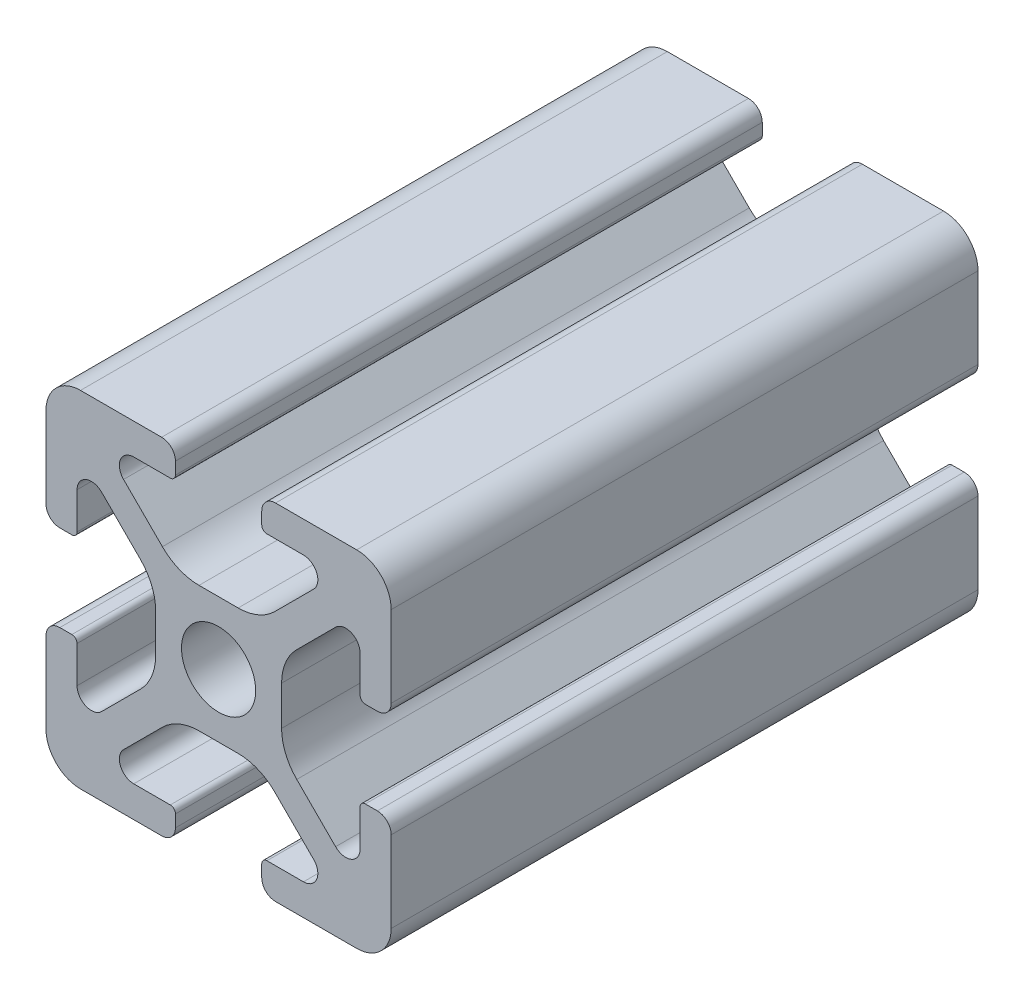
from build123d import *

# Parameters (mm, degrees)
ESQUISSE1_R        = 2.15
BOSS_EXTRU_1_DEPTH = 34


with BuildPart() as part:
    # Esquisse1 → Boss.-Extru.1 (new body)
    with BuildSketch(Plane(origin=(0, 0, 0), x_dir=(-1, 0, 0), z_dir=(0, 0, -1))):
        with BuildLine():
            Line((-12.499999997, 0.800000003), (-12.499999998, 1.500000003))
            ThreePointArc((-12.499999998, 1.500000003), (-12.587867964, 1.712132039), (-12.8, 1.800000005))
            Line((-12.8, 1.800000005), (-14.9175884, 1.800000005))
            ThreePointArc((-14.9175884, 1.800000005), (-15.686636444, 2.31386148), (-15.50619229, 3.2210155))
            Line((-15.50619229, 3.2210155), (-13.25588745, 5.47132034))
            ThreePointArc((-13.25588745, 5.47132034), (-12.282617404, 6.121638593), (-11.134567108, 6.349999996))
            Line((-11.134567108, 6.349999996), (-8.865432907, 6.349999996))
            ThreePointArc((-8.865432907, 6.349999996), (-7.717382611, 6.121638594), (-6.744112567, 5.471320341))
            Line((-6.744112567, 5.471320341), (-4.493807729, 3.221015503))
            ThreePointArc((-4.493807729, 3.221015503), (-4.313363575, 2.313861481), (-5.082411621, 1.800000005))
            Line((-5.082411621, 1.800000005), (-7.20000001, 1.800000005))
            ThreePointArc((-7.20000001, 1.800000005), (-7.412132045, 1.71213204), (-7.50000001, 1.500000005))
            Line((-7.50000001, 1.500000005), (-7.50000001, 0.8))
            ThreePointArc((-7.50000001, 0.8), (-7.265685435, 0.234314575), (-6.70000001, 0))
            Line((-6.70000001, 0), (-2, 0))
            ThreePointArc((-2, 0), (-0.585786438, 0.585786438), (0, 2))
            Line((0, 2), (0, 6.699999998))
            ThreePointArc((0, 6.699999998), (-0.234314576, 7.265685424), (-0.800000003, 7.5))
            Line((-0.800000003, 7.5), (-1.50000001, 7.5))
            ThreePointArc((-1.50000001, 7.5), (-1.712132046, 7.412132033), (-1.800000013, 7.199999997))
            Line((-1.800000013, 7.199999997), (-1.800000013, 5.082411603))
            ThreePointArc((-1.800000013, 5.082411603), (-2.313861487, 4.31336356), (-3.221015507, 4.493807713))
            Line((-3.221015507, 4.493807713), (-5.471320347, 6.744112553))
            ThreePointArc((-5.471320347, 6.744112553), (-6.1216386, 7.717382599), (-6.350000003, 8.865432896))
            Line((-6.350000003, 8.865432896), (-6.350000003, 11.134567102))
            ThreePointArc((-6.350000003, 11.134567102), (-6.121638601, 12.282617397), (-5.471320348, 13.255887442))
            Line((-5.471320348, 13.255887442), (-3.221015512, 15.506192278))
            ThreePointArc((-3.221015512, 15.506192278), (-2.313861489, 15.686636432), (-1.800000013, 14.917588386))
            Line((-1.800000013, 14.917588386), (-1.800000013, 12.799999998))
            ThreePointArc((-1.800000013, 12.799999998), (-1.712132047, 12.587867963), (-1.500000013, 12.499999997))
            Line((-1.500000013, 12.499999997), (-0.8, 12.499999997))
            ThreePointArc((-0.8, 12.499999997), (-0.234314575, 12.734314573), (0, 13.299999998))
            Line((0, 13.299999998), (0, 18))
            ThreePointArc((0, 18), (-0.585786438, 19.414213562), (-2, 20))
            Line((-2, 20), (-6.700000008, 20))
            ThreePointArc((-6.700000008, 20), (-7.265685435, 19.765685424), (-7.50000001, 19.199999998))
            Line((-7.50000001, 19.199999998), (-7.50000001, 18.500000005))
            ThreePointArc((-7.50000001, 18.500000005), (-7.412132044, 18.287867969), (-7.200000008, 18.200000003))
            Line((-7.200000008, 18.200000003), (-5.082411594, 18.200000003))
            ThreePointArc((-5.082411594, 18.200000003), (-4.313363546, 17.686138526), (-4.493807701, 16.778984501))
            Line((-4.493807701, 16.778984501), (-6.744112542, 14.528679659))
            ThreePointArc((-6.744112542, 14.528679659), (-7.717382588, 13.878361406), (-8.865432885, 13.650000003))
            Line((-8.865432885, 13.650000003), (-11.134567112, 13.650000003))
            ThreePointArc((-11.134567112, 13.650000003), (-12.282617407, 13.878361405), (-13.255887452, 14.528679658))
            Line((-13.255887452, 14.528679658), (-15.506192292, 16.778984498))
            ThreePointArc((-15.506192292, 16.778984498), (-15.686636447, 17.686138525), (-14.917588397, 18.200000002))
            Line((-14.917588397, 18.200000002), (-12.799999998, 18.200000003))
            ThreePointArc((-12.799999998, 18.200000003), (-12.587867963, 18.287867968), (-12.499999997, 18.500000002))
            Line((-12.499999997, 18.500000002), (-12.499999997, 19.2))
            ThreePointArc((-12.499999997, 19.2), (-12.734314573, 19.765685425), (-13.299999998, 20))
            Line((-13.299999998, 20), (-18, 20))
            ThreePointArc((-18, 20), (-19.414213562, 19.414213562), (-20, 18))
            Line((-20, 18), (-20, 13.3))
            ThreePointArc((-20, 13.3), (-19.765685424, 12.734314573), (-19.199999998, 12.499999997))
            Line((-19.199999998, 12.499999997), (-18.500000003, 12.499999997))
            ThreePointArc((-18.500000003, 12.499999997), (-18.287867967, 12.587867964), (-18.2, 12.8))
            Line((-18.2, 12.8), (-18.2, 14.91758839))
            ThreePointArc((-18.2, 14.91758839), (-17.686138526, 15.686636434), (-16.778984506, 15.50619228))
            Line((-16.778984506, 15.50619228), (-14.528679657, 13.255887431))
            ThreePointArc((-14.528679657, 13.255887431), (-13.878361403, 12.282617385), (-13.650000001, 11.134567088))
            Line((-13.650000001, 11.134567088), (-13.650000001, 8.865432886))
            ThreePointArc((-13.650000001, 8.865432886), (-13.878361403, 7.717382591), (-14.528679656, 6.744112546))
            Line((-14.528679656, 6.744112546), (-16.778984496, 4.493807706))
            ThreePointArc((-16.778984496, 4.493807706), (-17.686138522, 4.313363551), (-18.2, 5.0824116))
            Line((-18.2, 5.0824116), (-18.2, 7.2))
            ThreePointArc((-18.2, 7.2), (-18.287867966, 7.412132034), (-18.5, 7.5))
            Line((-18.5, 7.5), (-19.2, 7.5))
            ThreePointArc((-19.2, 7.5), (-19.765685425, 7.265685425), (-20, 6.7))
            Line((-20, 6.7), (-20, 2))
            ThreePointArc((-20, 2), (-19.414213562, 0.585786438), (-18, 0))
            Line((-18, 0), (-13.3, 0))
            ThreePointArc((-13.3, 0), (-12.734314573, 0.234314576), (-12.499999997, 0.800000003))
        make_face()
        with Locations(Location((-10, 10, 0), (0, 0, 180))):
            Circle(ESQUISSE1_R, mode=Mode.SUBTRACT)
    extrude(amount=-BOSS_EXTRU_1_DEPTH)


solid = part.part
